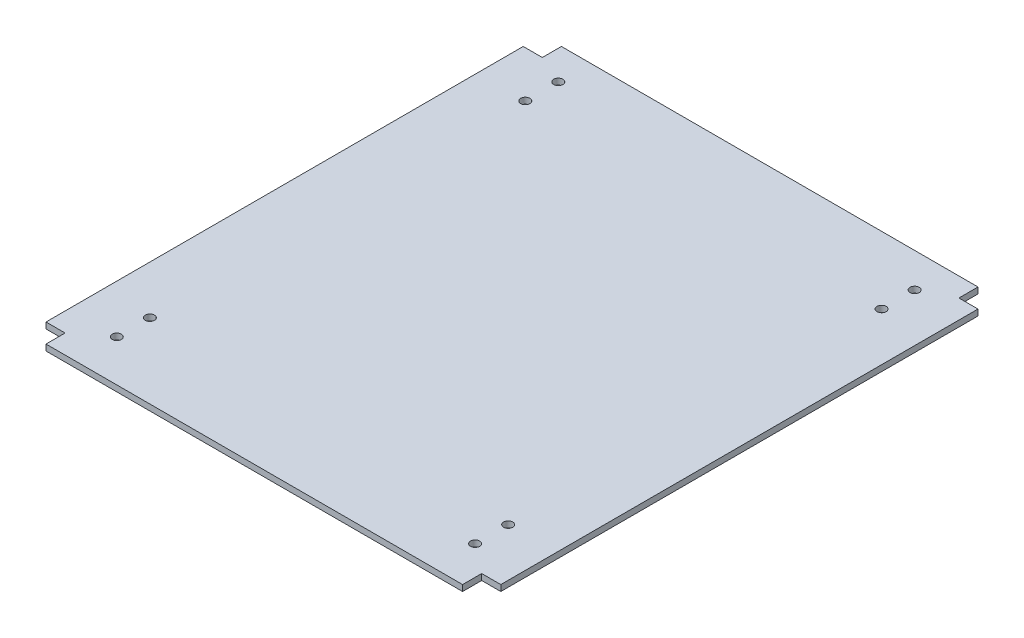
from build123d import *

# Parameters (mm, degrees)
BOSS_EXTRUDE4_DEPTH = 6.35
SKETCH4_R           = 4.826
CUT_EXTRUDE1_DEPTH  = 109.474
SKETCH5_R           = 4.826
CUT_EXTRUDE2_DEPTH  = 42.164
SKETCH6_R           = 4.826
CUT_EXTRUDE3_DEPTH  = 90.932
SKETCH7_R           = 4.826
CUT_EXTRUDE4_DEPTH  = 90.932


with BuildPart() as part:
    # Sketch1 → Boss-Extrude4 (new body)
    with BuildSketch(Plane(origin=(0, 0, 0), x_dir=(1, 0, 0), z_dir=(0, 1, 0))):
        Polygon((-218.125, 269.875), (218.125, 269.875), (218.125, 249.875), (238.125, 249.875), (238.125, -249.875), (218.125, -249.875), (218.125, -269.875), (-218.125, -269.875), (-218.125, -249.875), (-238.125, -249.875), (-238.125, 249.875), (-218.125, 249.875), align=None)
    extrude(amount=BOSS_EXTRUDE4_DEPTH)

    # Sketch4 → Cut-Extrude1 (cut)
    with BuildSketch(Plane(origin=(-189.734229067, -3, -427.845388044), x_dir=(1, 0, 0), z_dir=(0, -1, 0))):
        with Locations(Location((2.104243746, 226.324422281, 0), (0, 0, 270))):
            Circle(SKETCH4_R)
        with Locations(Location((2.104243746, 191.724422281, 0), (0, 0, 270))):
            Circle(SKETCH4_R)
    extrude(amount=-CUT_EXTRUDE1_DEPTH, mode=Mode.SUBTRACT)

    # Sketch5 → Cut-Extrude2 (cut)
    with BuildSketch(Plane(origin=(-189.734229067, 0, -427.845388044), x_dir=(-1, 0, 0), z_dir=(0, -1, 0))):
        with Locations(Location((-377.374414389, -228.445283948, 0), (0, 0, 90))):
            Circle(SKETCH5_R)
        with Locations(Location((-377.374414389, -193.845283948, 0), (0, 0, 90))):
            Circle(SKETCH5_R)
    extrude(amount=-CUT_EXTRUDE2_DEPTH, mode=Mode.SUBTRACT)

    # Sketch6 → Cut-Extrude3 (cut)
    with BuildSketch(Plane(origin=(-189.734229067, -3, -427.845388044), x_dir=(1, 0, 0), z_dir=(0, -1, 0))):
        with Locations(Location((2.104243746, 654.101705956, 0), (0, 0, 270))):
            Circle(SKETCH6_R)
        with Locations(Location((2.104243746, 619.501705956, 0), (0, 0, 270))):
            Circle(SKETCH6_R)
    extrude(amount=-CUT_EXTRUDE3_DEPTH, mode=Mode.SUBTRACT)

    # Sketch7 → Cut-Extrude4 (cut)
    with BuildSketch(Plane(origin=(-189.734229067, -3, -427.845388044), x_dir=(1, 0, 0), z_dir=(0, -1, 0))):
        with Locations(Location((377.374414389, 654.101705956, 0), (0, 0, 270))):
            Circle(SKETCH7_R)
        with Locations(Location((377.374414389, 619.501705956, 0), (0, 0, 270))):
            Circle(SKETCH7_R)
    extrude(amount=-CUT_EXTRUDE4_DEPTH, mode=Mode.SUBTRACT)


solid = part.part
